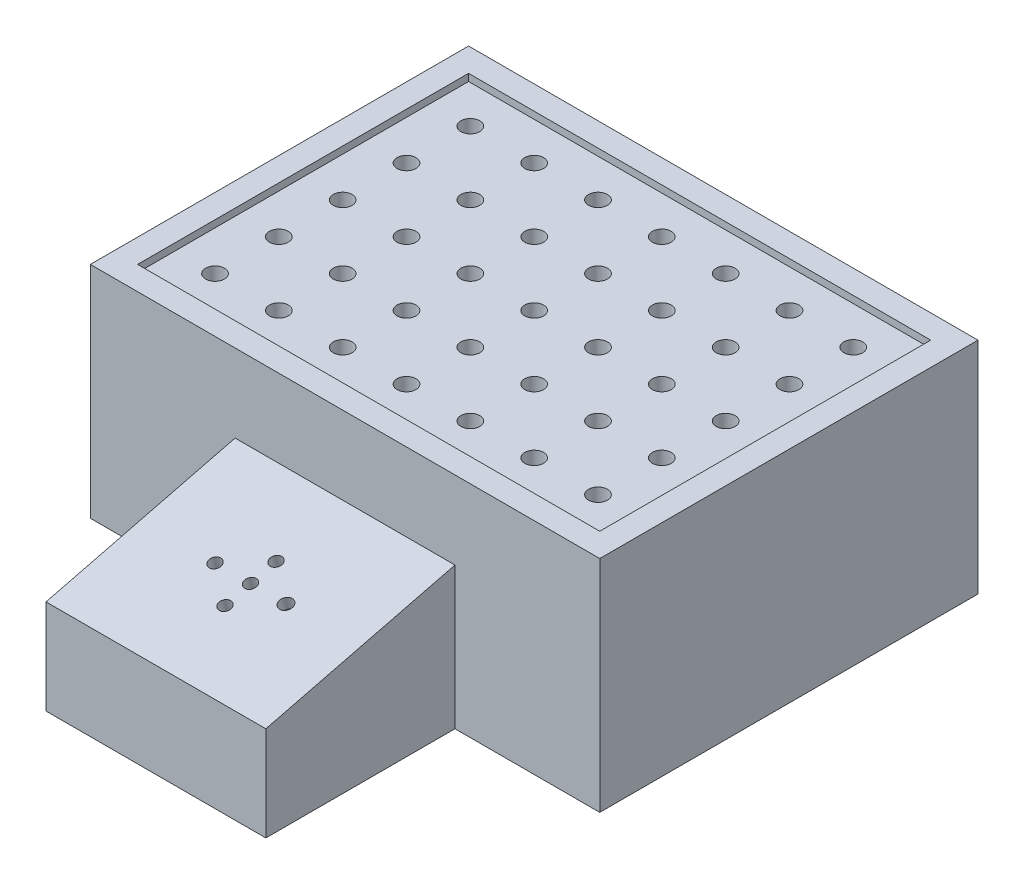
from build123d import *

# Parameters (mm, degrees)
ESBO_O1_W                = 215.5
ESBO_O1_H                = 160
RESSALTO_EXTRUS_O1_DEPTH = 90
ESBO_O2_W                = 93
ESBO_O2_H                = 60
RESSALTO_EXTRUS_O2_DEPTH = 80
CORTE_EXTRUS_O1_REACH    = 241.777
ESBO_O4_R                = 2.5
ESBO_O4_R_2              = 2.72809557
CORTE_EXTRUS_O2_DEPTH    = 5
ESBO_O5_W                = 215.5
ESBO_O5_H                = 160
ESBO_O5_W_2              = 195.5
ESBO_O5_H_2              = 140
RESSALTO_EXTRUS_O3_DEPTH = 3
ESBO_O6_R                = 4
CORTE_EXTRUS_O3_DEPTH    = 10


with BuildPart() as part:
    # Esboço1 → Ressalto-extrusão1 (new body)
    with BuildSketch(Plane(origin=(0, 0, 0), x_dir=(1, 0, 0), z_dir=(0, 1, 0))):
        Rectangle(ESBO_O1_W, ESBO_O1_H)
    extrude(amount=RESSALTO_EXTRUS_O1_DEPTH)

    # Esboço2 → Ressalto-extrusão2 (add)
    with BuildSketch(Plane.XY.offset(80)):
        with Locations((0, 30)):
            Rectangle(ESBO_O2_W, ESBO_O2_H)
    extrude(amount=RESSALTO_EXTRUS_O2_DEPTH)

    # Esboço3 → Corte-extrusão1 (cut, up to next)
    with BuildSketch(Plane.ZY.offset(46.5), mode=Mode.PRIVATE) as corte_extrus_o1_sk1:
        Polygon((160, 60), (160, 40), (80, 60), align=None)
    corte_extrus_o1_tool1 = extrude(corte_extrus_o1_sk1.sketch, amount=-CORTE_EXTRUS_O1_REACH, mode=Mode.PRIVATE) & part.part
    add(corte_extrus_o1_tool1.solids().sort_by_distance((-46.5, 53.333333, 133.333333))[0], mode=Mode.SUBTRACT)

    # Esboço4 → Corte-extrusão2 (cut)
    with BuildSketch(Plane(origin=(0, 75.294117647, 18.823529412), x_dir=(1, 0, 0), z_dir=(0, 0.9701425001453319, 0.24253562503633308))):
        with Locations(Location((0, -115.409748765, 0), (0, 0, 270))):
            Circle(ESBO_O4_R)
        with Locations(Location((-15, -104.290318766, 0), (0, 0, 270))):
            Circle(ESBO_O4_R)
        with Locations(Location((0, -93.170888766, 0), (0, 0, 270))):
            Circle(ESBO_O4_R)
        with Locations(Location((0, -104.290318766, 0), (0, 0, 270))):
            Circle(ESBO_O4_R)
        with Locations(Location((15, -104.290318766, 0), (0, 0, 270))):
            Circle(ESBO_O4_R_2)
    extrude(amount=-CORTE_EXTRUS_O2_DEPTH, mode=Mode.SUBTRACT)

    # Esboço5 → Ressalto-extrusão3 (add)
    with BuildSketch(Plane(origin=(0, 90, 0), x_dir=(1, 0, 0), z_dir=(0, 1, 0))):
        Rectangle(ESBO_O5_W, ESBO_O5_H)
        Rectangle(ESBO_O5_W_2, ESBO_O5_H_2, mode=Mode.SUBTRACT)
    extrude(amount=RESSALTO_EXTRUS_O3_DEPTH)

    # Esboço6 → Corte-extrusão3 (cut)
    with BuildSketch(Plane(origin=(0, 90, 0), x_dir=(1, 0, 0), z_dir=(0, 1, 0))):
        with Locations(Location((-81, 54, 0), (0, 0, 270))):
            Circle(ESBO_O6_R)
        with Locations(Location((-54, 54, 0), (0, 0, 270))):
            Circle(ESBO_O6_R)
        with Locations(Location((-27, 54, 0), (0, 0, 270))):
            Circle(ESBO_O6_R)
        with Locations(Location((0, 54, 0), (0, 0, 270))):
            Circle(ESBO_O6_R)
        with Locations(Location((27, 54, 0), (0, 0, 270))):
            Circle(ESBO_O6_R)
        with Locations(Location((54, 54, 0), (0, 0, 270))):
            Circle(ESBO_O6_R)
        with Locations(Location((81, 54, 0), (0, 0, 270))):
            Circle(ESBO_O6_R)
        with Locations(Location((81, 27, 0), (0, 0, 270))):
            Circle(ESBO_O6_R)
        with Locations(Location((54, 27, 0), (0, 0, 270))):
            Circle(ESBO_O6_R)
        with Locations(Location((27, 27, 0), (0, 0, 270))):
            Circle(ESBO_O6_R)
        with Locations(Location((0, 27, 0), (0, 0, 270))):
            Circle(ESBO_O6_R)
        with Locations(Location((-27, 27, 0), (0, 0, 270))):
            Circle(ESBO_O6_R)
        with Locations(Location((-54, 27, 0), (0, 0, 270))):
            Circle(ESBO_O6_R)
        with Locations(Location((-81, 27, 0), (0, 0, 270))):
            Circle(ESBO_O6_R)
        with Locations(Location((-81, 0, 0), (0, 0, 270))):
            Circle(ESBO_O6_R)
        with Locations(Location((-54, 0, 0), (0, 0, 270))):
            Circle(ESBO_O6_R)
        with Locations(Location((-27, 0, 0), (0, 0, 270))):
            Circle(ESBO_O6_R)
        with Locations(Location((0, 0, 0), (0, 0, 270))):
            Circle(ESBO_O6_R)
        with Locations(Location((27, 0, 0), (0, 0, 270))):
            Circle(ESBO_O6_R)
        with Locations(Location((54, 0, 0), (0, 0, 270))):
            Circle(ESBO_O6_R)
        with Locations(Location((81, 0, 0), (0, 0, 270))):
            Circle(ESBO_O6_R)
        with Locations(Location((81, -27, 0), (0, 0, 270))):
            Circle(ESBO_O6_R)
        with Locations(Location((54, -27, 0), (0, 0, 270))):
            Circle(ESBO_O6_R)
        with Locations(Location((27, -27, 0), (0, 0, 270))):
            Circle(ESBO_O6_R)
        with Locations(Location((0, -27, 0), (0, 0, 270))):
            Circle(ESBO_O6_R)
        with Locations(Location((-27, -27, 0), (0, 0, 270))):
            Circle(ESBO_O6_R)
        with Locations(Location((-54, -27, 0), (0, 0, 270))):
            Circle(ESBO_O6_R)
        with Locations(Location((-81, -27, 0), (0, 0, 270))):
            Circle(ESBO_O6_R)
        with Locations(Location((-81, -54, 0), (0, 0, 270))):
            Circle(ESBO_O6_R)
        with Locations(Location((-54, -54, 0), (0, 0, 270))):
            Circle(ESBO_O6_R)
        with Locations(Location((-27, -54, 0), (0, 0, 270))):
            Circle(ESBO_O6_R)
        with Locations(Location((0, -54, 0), (0, 0, 270))):
            Circle(ESBO_O6_R)
        with Locations(Location((27, -54, 0), (0, 0, 270))):
            Circle(ESBO_O6_R)
        with Locations(Location((54, -54, 0), (0, 0, 270))):
            Circle(ESBO_O6_R)
        with Locations(Location((81, -54, 0), (0, 0, 270))):
            Circle(ESBO_O6_R)
    extrude(amount=-CORTE_EXTRUS_O3_DEPTH, mode=Mode.SUBTRACT)


solid = part.part
